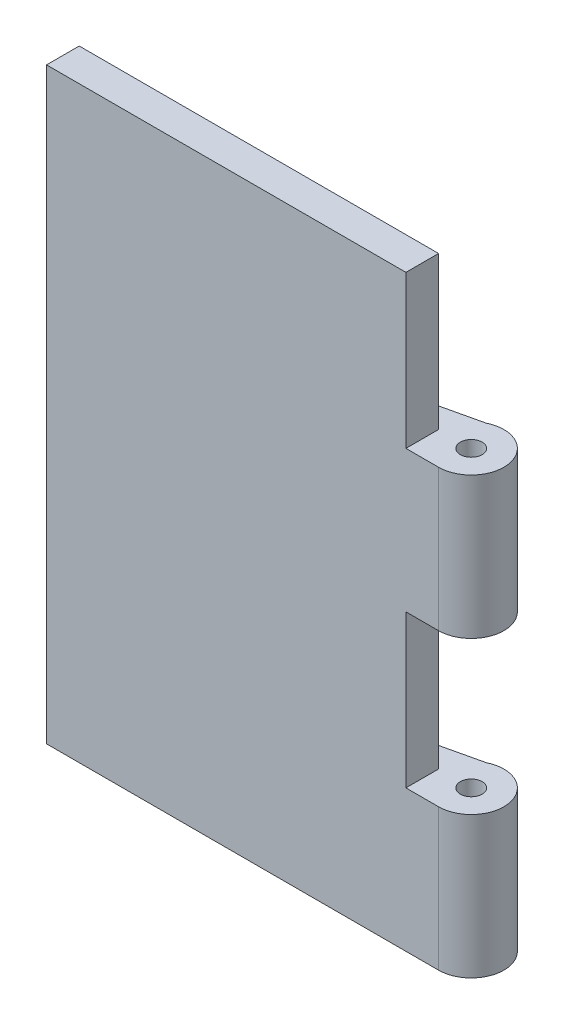
from build123d import *

# Parameters (mm, degrees)
BOSS_EXTRUDE1_DEPTH = 6.5
SKETCH2_W           = 15
SKETCH2_H           = 1.5
BOSS_EXTRUDE2_DEPTH = 7
BOSS_EXTRUDE3_DEPTH = 6.5
SKETCH4_W           = 15
SKETCH4_H           = 1.5
BOSS_EXTRUDE4_DEPTH = 7
SKETCH5_R           = 0.5
CUT_EXTRUDE1_DEPTH  = 27
SKETCH6_W           = 1.5
SKETCH6_H           = 27
BOSS_EXTRUDE5_DEPTH = 1.5


with BuildPart() as part:
    # Sketch1 → Boss-Extrude1 (new body)
    with BuildSketch(Plane(origin=(0, 0, 0), x_dir=(1, 0, 0), z_dir=(0, 1, 0))):
        with BuildLine():
            Line((-7.5, -0.75), (9, -0.75))
            ThreePointArc((9, -0.75), (10.461586794, 1.08728926), (8.342696629, 2.098314607))
            Line((8.342696629, 2.098314607), (2.5, 0.75))
            Line((2.5, 0.75), (-7.5, 0.75))
            Line((-7.5, 0.75), (-7.5, -0.75))
        make_face()
    extrude(amount=BOSS_EXTRUDE1_DEPTH)

    # Sketch2 → Boss-Extrude2 (add)
    with BuildSketch(Plane(origin=(0, 6.5, 0), x_dir=(1, 0, 0), z_dir=(0, 1, 0))):
        Rectangle(SKETCH2_W, SKETCH2_H)
    extrude(amount=BOSS_EXTRUDE2_DEPTH)

    # Sketch3 → Boss-Extrude3 (add)
    with BuildSketch(Plane(origin=(0, 13.5, 0), x_dir=(1, 0, 0), z_dir=(0, 1, 0))):
        with BuildLine():
            Line((-7.5, -0.75), (9, -0.75))
            ThreePointArc((9, -0.75), (10.461586794, 1.08728926), (8.342696629, 2.098314607))
            Line((8.342696629, 2.098314607), (2.5, 0.75))
            Line((2.5, 0.75), (-7.5, 0.75))
            Line((-7.5, 0.75), (-7.5, -0.75))
        make_face()
    extrude(amount=BOSS_EXTRUDE3_DEPTH)

    # Sketch4 → Boss-Extrude4 (add)
    with BuildSketch(Plane(origin=(0, 20, 0), x_dir=(1, 0, 0), z_dir=(0, 1, 0))):
        Rectangle(SKETCH4_W, SKETCH4_H)
    extrude(amount=BOSS_EXTRUDE4_DEPTH)

    # Sketch5 → Cut-Extrude1 (cut)
    with BuildSketch(Plane.XZ):
        with Locations(Location((9, -0.75, 0), (0, 0, 90))):
            Circle(SKETCH5_R)
    extrude(amount=-CUT_EXTRUDE1_DEPTH, mode=Mode.SUBTRACT)

    # Sketch6 → Boss-Extrude5 (add)
    with BuildSketch(Plane.ZY.offset(7.5)):
        with Locations((0, 13.5)):
            Rectangle(SKETCH6_W, SKETCH6_H)
    extrude(amount=BOSS_EXTRUDE5_DEPTH)


solid = part.part
